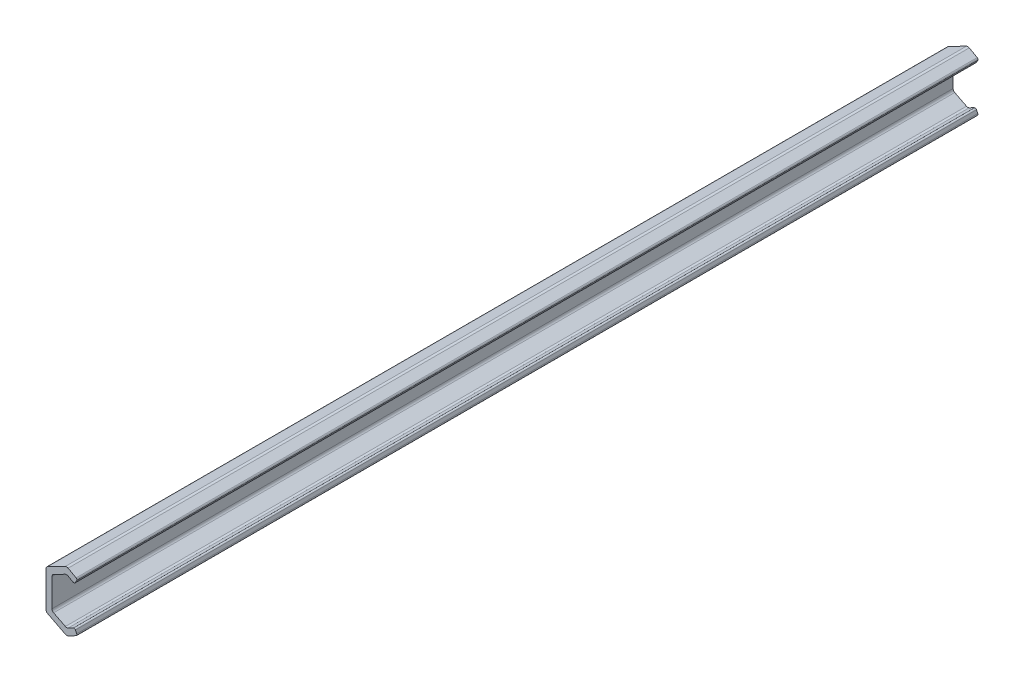
from build123d import *

# Parameters (mm, degrees)
BOSS_EXTRUDE1_DEPTH = 300


with BuildPart() as part:
    # Sketch1 → Boss-Extrude1 (new body)
    with BuildSketch(Plane.XY):
        with BuildLine():
            Line((-91.294722728, 32.46442764), (-91.294722728, 20.694912783))
            ThreePointArc((-91.294722728, 20.694912783), (-91.146889418, 20.171642364), (-90.747098865, 19.803085541))
            Line((-90.747098865, 19.803085541), (-84.844741925, 16.809136368))
            ThreePointArc((-84.844741925, 16.809136368), (-84.392365787, 16.70096361), (-83.93998965, 16.809136368))
            Line((-83.93998965, 16.809136368), (-81.288279408, 18.15420678))
            ThreePointArc((-81.288279408, 18.15420678), (-81.039219814, 18.444750973), (-81.068553856, 18.82630847))
            Line((-81.068553856, 18.82630847), (-81.520929993, 19.718135713))
            ThreePointArc((-81.520929993, 19.718135713), (-81.811474186, 19.967195307), (-82.193031683, 19.937861265))
            Line((-82.193031683, 19.937861265), (-83.93998965, 19.051723166))
            ThreePointArc((-83.93998965, 19.051723166), (-84.392365787, 18.943550409), (-84.844741925, 19.051723166))
            Line((-84.844741925, 19.051723166), (-88.747098865, 21.031179585))
            ThreePointArc((-88.747098865, 21.031179585), (-89.146889418, 21.399736409), (-89.294722728, 21.923006828))
            Line((-89.294722728, 21.923006828), (-89.294722728, 31.236333595))
            ThreePointArc((-89.294722728, 31.236333595), (-89.146889418, 31.759604014), (-88.747098865, 32.128160837))
            Line((-88.747098865, 32.128160837), (-84.905483334, 34.076806397))
            ThreePointArc((-84.905483334, 34.076806397), (-84.435217001, 34.184819112), (-83.969115812, 34.060051917))
            Line((-83.969115812, 34.060051917), (-82.247884938, 33.108061465))
            ThreePointArc((-82.247884938, 33.108061465), (-81.867621098, 33.065096109), (-81.568352864, 33.303602154))
            Line((-81.568352864, 33.303602154), (-81.084361479, 34.178674916))
            ThreePointArc((-81.084361479, 34.178674916), (-81.041396123, 34.558938756), (-81.279902168, 34.85820699))
            Line((-81.279902168, 34.85820699), (-83.928621539, 36.323179288))
            ThreePointArc((-83.928621539, 36.323179288), (-84.394722728, 36.447946483), (-84.864989061, 36.339933768))
            Line((-84.864989061, 36.339933768), (-90.747098865, 33.356254882))
            ThreePointArc((-90.747098865, 33.356254882), (-91.146889418, 32.987698058), (-91.294722728, 32.46442764))
        make_face()
    extrude(amount=BOSS_EXTRUDE1_DEPTH)


solid = part.part
